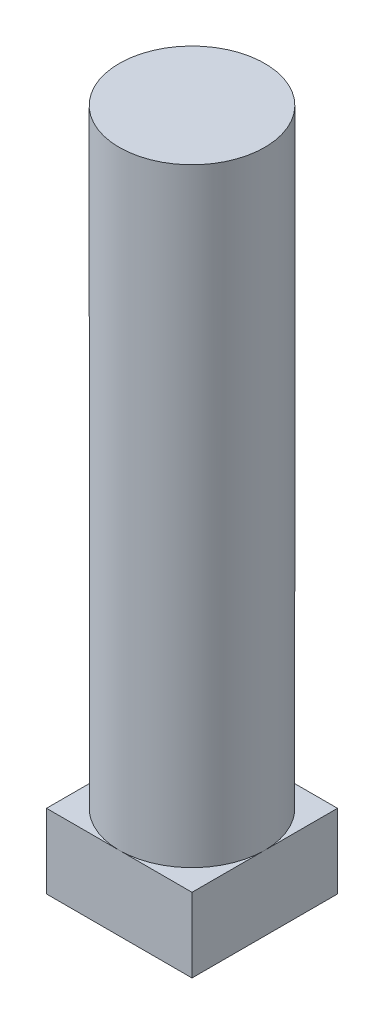
from build123d import *

# Parameters (mm, degrees)
SKETCH1_W           = 4.9
SKETCH1_H           = 4.9
BOSS_EXTRUDE1_DEPTH = 2.5
SKETCH2_R           = 2.45
BOSS_EXTRUDE2_DEPTH = 20.5


with BuildPart() as part:
    # Sketch1 → Boss-Extrude1 (new body)
    with BuildSketch(Plane(origin=(0, 0, 0), x_dir=(1, 0, 0), z_dir=(0, 1, 0))):
        Rectangle(SKETCH1_W, SKETCH1_H)
    extrude(amount=BOSS_EXTRUDE1_DEPTH)

    # Sketch2 → Boss-Extrude2 (add)
    with BuildSketch(Plane(origin=(0, 2.5, 0), x_dir=(1, 0, 0), z_dir=(0, 1, 0))):
        with Locations(Location((0, 0, 0), (0, 0, 270))):
            Circle(SKETCH2_R)
    extrude(amount=BOSS_EXTRUDE2_DEPTH)


solid = part.part
